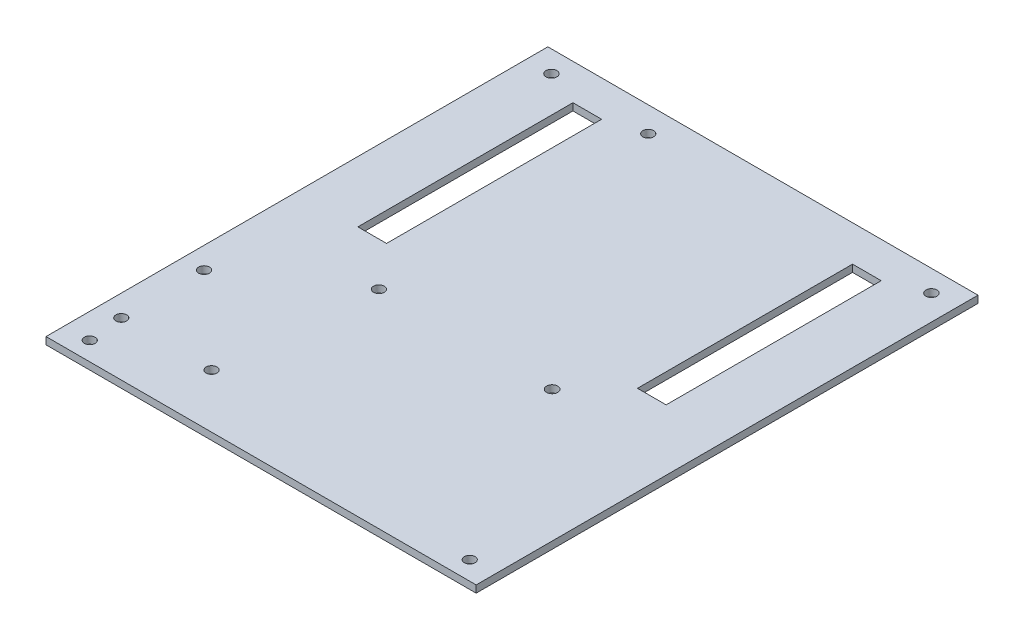
from build123d import *

# Parameters (mm, degrees)
SKETCH1_W           = 120
SKETCH1_H           = 140
BOSS_EXTRUDE1_DEPTH = 2
SKETCH2_R           = 1.525
SKETCH2_R_2         = 1.5
CUT_EXTRUDE1_DEPTH  = 2
SKETCH4_R           = 1.5
SKETCH4_R_2         = 1.55
SKETCH4_W           = 8
SKETCH4_H           = 60
CUT_EXTRUDE2_DEPTH  = 93.217135067
SKETCH5_R           = 1.5
CUT_EXTRUDE3_DEPTH  = 93.217135067


with BuildPart() as part:
    # Sketch1 → Boss-Extrude1 (new body)
    with BuildSketch(Plane(origin=(0, 0, 0), x_dir=(1, 0, 0), z_dir=(0, 1, 0))):
        Rectangle(SKETCH1_W, SKETCH1_H)
    extrude(amount=BOSS_EXTRUDE1_DEPTH)

    # Sketch2 → Cut-Extrude1 (cut)
    with BuildSketch(Plane(origin=(0, 2, 0), x_dir=(1, 0, 0), z_dir=(0, 1, 0))):
        with Locations(Location((-53, 64, 0), (0, 0, 270))):
            Circle(SKETCH2_R)
        with Locations(Location((-53, -64.8, 0), (0, 0, 270))):
            Circle(SKETCH2_R_2)
        with Locations(Location((53, 64, 0), (0, 0, 90))):
            Circle(SKETCH2_R)
        with Locations(Location((53, -64.8, 0), (0, 0, 90))):
            Circle(SKETCH2_R_2)
    extrude(amount=-CUT_EXTRUDE1_DEPTH, mode=Mode.SUBTRACT)

    # Sketch4 → Cut-Extrude2 (cut, through all)
    with BuildSketch(Plane(origin=(0, 2, 0), x_dir=(1, 0, 0), z_dir=(0, 1, 0))):
        with Locations(Location((-25, 63, 0), (0, 0, 270))):
            Circle(SKETCH4_R)
        with Locations(Location((-25, -12.13, 0), (0, 0, 270))):
            Circle(SKETCH4_R)
        with Locations(Location((23.33, -12.13, 0), (0, 0, 270))):
            Circle(SKETCH4_R_2)
        with Locations((-39, 30)):
            Rectangle(SKETCH4_W, SKETCH4_H)
        with Locations((39, 30)):
            Rectangle(SKETCH4_W, SKETCH4_H)
    extrude(amount=-CUT_EXTRUDE2_DEPTH, mode=Mode.SUBTRACT)

    # Sketch5 → Cut-Extrude3 (cut, through all)
    with BuildSketch(Plane(origin=(0, 2, 0), x_dir=(1, 0, 0), z_dir=(0, 1, 0))):
        with Locations(Location((-54, -55, 0), (0, 0, 270))):
            Circle(SKETCH5_R)
        with Locations(Location((-28.82, -55, 0), (0, 0, 270))):
            Circle(SKETCH5_R)
        with Locations(Location((-54, -31.9, 0), (0, 0, 270))):
            Circle(SKETCH5_R)
    extrude(amount=-CUT_EXTRUDE3_DEPTH, mode=Mode.SUBTRACT)


solid = part.part
